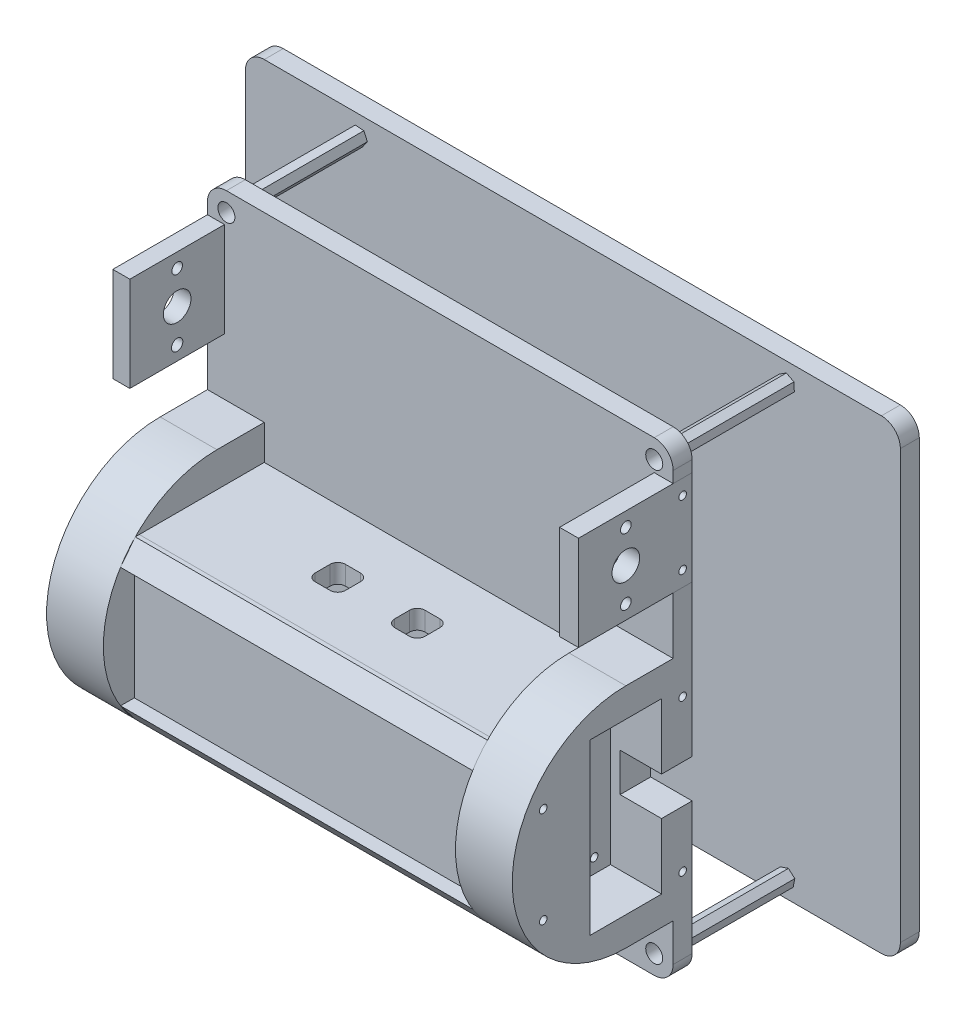
from build123d import *

# Parameters (mm, degrees)
RESSALTO_EXTRUS_O1_DEPTH      = 5
ESBO_O4_W                     = 4.495494134
ESBO_O4_H                     = 25
CORTE_EXTRUS_O2_DEPTH         = 5
RESSALTO_EXTRUS_O2_DEPTH      = 25
RESSALTO_EXTRUS_O2_DEPTH_BACK = 5
ESBO_O5_W                     = 4.495494134
ESBO_O5_H                     = 25
ESBO_O6_R                     = 1
CORTE_EXTRUS_O3_DEPTH         = 10
ESBO_O7_R                     = 1
CORTE_EXTRUS_O4_DEPTH         = 10
ESBO_O8_R                     = 3.65
CORTE_EXTRUS_O5_DEPTH         = 10
ESBO_O9_R                     = 1.4
CORTE_EXTRUS_O6_DEPTH         = 10
ESBO_O10_R                    = 1.5
CORTE_EXTRUS_O7_DEPTH         = 10
ESBO_O11_W                    = 5
ESBO_O11_H                    = 25
CORTE_EXTRUS_O8_DEPTH         = 10
RESSALTO_EXTRUS_O3_DEPTH      = 25
RESSALTO_EXTRUS_O3_DEPTH_BACK = 5
ESBO_O16_W                    = 5
ESBO_O16_H                    = 25
CORTE_EXTRUS_O9_START         = -10
ESBO_O17_R                    = 1
CORTE_EXTRUS_O9_DEPTH         = 10
CORTE_EXTRUS_O10_START        = -10
ESBO_O18_R                    = 1
CORTE_EXTRUS_O10_DEPTH        = 10
ESBO_O20_R                    = 3.65
CORTE_EXTRUS_O11_DEPTH        = 6
ESBO_O22_R                    = 1.4
CORTE_EXTRUS_O12_DEPTH        = 5
ESBO_O23_R                    = 1.4
CORTE_EXTRUS_O13_DEPTH        = 5
ESBO_O24_W                    = 15
ESBO_O24_H                    = 60
CORTE_EXTRUS_O14_DEPTH        = 10
ESBO_O27_W                    = 15
ESBO_O27_H                    = 60
CORTE_EXTRUS_O16_DEPTH        = 25
RESSALTO_EXTRUS_O7_DEPTH      = 12.5
RESSALTO_EXTRUS_O7_DEPTH_BACK = 5
ESBO_O32_W                    = 15
ESBO_O32_H                    = 60
RESSALTO_EXTRUS_O8_DEPTH      = 15
RESSALTO_EXTRUS_O9_DEPTH      = 12.5
RESSALTO_EXTRUS_O9_DEPTH_BACK = 5
ESBO_O34_W                    = 15
ESBO_O34_H                    = 60
RESSALTO_EXTRUS_O10_DEPTH     = 15
ESBO_O36_R                    = 1
CORTE_EXTRUS_O18_DEPTH        = 20
CORTE_EXTRUS_O19_START        = -20
ESBO_O37_R                    = 1
CORTE_EXTRUS_O19_DEPTH        = 20
ESBO_O39_W                    = 18.85
ESBO_O39_H                    = 44.705
CORTE_EXTRUS_O20_DEPTH        = 13.49
ESBO_O43_W                    = 10.95
ESBO_O43_H                    = 10.16
CORTE_EXTRUS_O23_DEPTH        = 10
ESBO_O44_W                    = 33
ESBO_O44_H                    = 5
RESSALTO_EXTRUS_O11_DEPTH     = 93
ESBO_O47_W                    = 33
ESBO_O47_H                    = 5
RESSALTO_EXTRUS_O12_DEPTH     = 93
ESBO_O41_R                    = 1.6255
ESBO_O41_R_2                  = 1
CORTE_EXTRUS_O25_DEPTH        = 31
ESBO_O42_R                    = 1.6255
ESBO_O42_R_2                  = 1
CORTE_EXTRUS_O26_DEPTH        = 31
ESBO_O52_W                    = 18.85
ESBO_O52_H                    = 44.705
CORTE_EXTRUS_O27_DEPTH        = 13.49
ESBO_O54_W                    = 10.951
ESBO_O54_H                    = 10.16
CORTE_EXTRUS_O28_DEPTH        = 24
ESBO_O55_R                    = 1.6255
ESBO_O55_R_2                  = 1
CORTE_EXTRUS_O29_DEPTH        = 31
ESBO_O56_W                    = 5
ESBO_O56_H                    = 31.69504285
RESSALTO_EXTRUS_O13_DEPTH     = 93
RESSALTO_EXTRUS_O15_DEPTH     = 93
RESSALTO_EXTRUS_O16_DEPTH     = 93
ESBO_O62_R                    = 1
CORTE_EXTRUS_O30_DEPTH        = 14
CORTE_EXTRUS_O31_DEPTH        = 10
ESBO_O65_R                    = 2.25
CORTE_EXTRUS_O32_DEPTH        = 10
RESSALTO_EXTRUS_O17_DEPTH     = 30
RESSALTO_EXTRUS_O17_2_DEPTH   = 30
RESSALTO_EXTRUS_O17_3_DEPTH   = 30
RESSALTO_EXTRUS_O17_4_DEPTH   = 30
RESSALTO_EXTRUS_O18_DEPTH     = 5
ESBO_O69_R                    = 1.6255
CORTE_EXTRUS_O33_DEPTH        = 10
ESBO_O71_R                    = 1.6255
CORTE_EXTRUS_O34_DEPTH        = 10


with BuildPart() as part:
    # Esboço1 → Ressalto-extrusão1 (new body)
    with BuildSketch(Plane.XY):
        with BuildLine():
            Line((-47.810925728, 58.485502959), (65.189074272, 58.485502959))
            ThreePointArc((65.189074272, 58.485502959), (68.724608178, 57.021036865), (70.189074272, 53.485502959))
            Line((70.189074272, 53.485502959), (70.189074272, -59.514497041))
            ThreePointArc((70.189074272, -59.514497041), (68.724608178, -63.050030947), (65.189074272, -64.514497041))
            Line((65.189074272, -64.514497041), (-47.810925728, -64.514497041))
            ThreePointArc((-47.810925728, -64.514497041), (-51.346459634, -63.050030947), (-52.810925728, -59.514497041))
            Line((-52.810925728, -59.514497041), (-52.810925728, 53.485502959))
            ThreePointArc((-52.810925728, 53.485502959), (-51.346459634, 57.021036865), (-47.810925728, 58.485502959))
        make_face()
    extrude(amount=RESSALTO_EXTRUS_O1_DEPTH)

    # Esboço4 → Corte-extrusão2 (cut)
    with BuildSketch(Plane.XY.offset(5)):
        with Locations((-50.563178661, 37.985502959)):
            Rectangle(ESBO_O4_W, ESBO_O4_H)
    extrude(amount=-CORTE_EXTRUS_O2_DEPTH, mode=Mode.SUBTRACT)


with BuildPart() as body_2:
    # Esboço5 → Ressalto-extrusão2 (new, two sides: drawn at the far end of the back side and taken through both)
    with BuildSketch(Plane.XY.offset(5).offset(-RESSALTO_EXTRUS_O2_DEPTH_BACK)):
        with Locations((-50.563178661, 37.985502959)):
            Rectangle(ESBO_O5_W, ESBO_O5_H)
    extrude(amount=RESSALTO_EXTRUS_O2_DEPTH + RESSALTO_EXTRUS_O2_DEPTH_BACK)


with BuildPart() as corte_extrus_o3_tool:
    # Esboço6 → Corte-extrusão3 (new body)
    with BuildSketch(Plane.ZY.offset(52.810925728)):
        with Locations((2.5, 46.485502959)):
            Circle(ESBO_O6_R)
    extrude(amount=-CORTE_EXTRUS_O3_DEPTH)


with BuildPart() as part_1:
    add(part.part)

    # Corte-extrusão3: cut by corte_extrus_o3_tool
    add(corte_extrus_o3_tool.part, mode=Mode.SUBTRACT)


with BuildPart() as body_2_1:
    add(body_2.part)

    # Corte-extrusão3: cut by corte_extrus_o3_tool
    add(corte_extrus_o3_tool.part, mode=Mode.SUBTRACT)


with BuildPart() as corte_extrus_o4_tool:
    # Esboço7 → Corte-extrusão4 (new body)
    with BuildSketch(Plane.ZY.offset(52.810925728)):
        with Locations((2.5, 29.485502959)):
            Circle(ESBO_O7_R)
    extrude(amount=-CORTE_EXTRUS_O4_DEPTH)


with BuildPart() as part_2:
    add(part_1.part)

    # Corte-extrusão4: cut by corte_extrus_o4_tool
    add(corte_extrus_o4_tool.part, mode=Mode.SUBTRACT)

    # Esboço11 → Corte-extrusão8 (cut)
    with BuildSketch(Plane.XY.offset(5)):
        with Locations((67.689074272, 37.985502959)):
            Rectangle(ESBO_O11_W, ESBO_O11_H)
    extrude(amount=-CORTE_EXTRUS_O8_DEPTH, mode=Mode.SUBTRACT)


with BuildPart() as body_2_2:
    add(body_2_1.part)

    # Corte-extrusão4: cut by corte_extrus_o4_tool
    add(corte_extrus_o4_tool.part, mode=Mode.SUBTRACT)

    # Esboço8 → Corte-extrusão5 (cut)
    with BuildSketch(Plane(origin=(-48.315431594, 0, 0), x_dir=(0, 0, -1), z_dir=(1, 0, 0))):
        with Locations((-17.5, 37.985502959)):
            Circle(ESBO_O8_R)
    extrude(amount=-CORTE_EXTRUS_O5_DEPTH, mode=Mode.SUBTRACT)

    # Esboço9 → Corte-extrusão6 (cut)
    with BuildSketch(Plane.ZY.offset(52.810925728)):
        with Locations((17.5, 46.735502959)):
            Circle(ESBO_O9_R)
    extrude(amount=-CORTE_EXTRUS_O6_DEPTH, mode=Mode.SUBTRACT)

    # Esboço10 → Corte-extrusão7 (cut)
    with BuildSketch(Plane.ZY.offset(52.810925728)):
        with Locations((17.5, 29.235502959)):
            Circle(ESBO_O10_R)
    extrude(amount=-CORTE_EXTRUS_O7_DEPTH, mode=Mode.SUBTRACT)


with BuildPart() as body_3:
    # Esboço16 → Ressalto-extrusão3 (new, two sides: drawn at the far end of the back side and taken through both)
    with BuildSketch(Plane.XY.offset(5).offset(-RESSALTO_EXTRUS_O3_DEPTH_BACK)):
        with Locations((67.689074272, 37.985502959)):
            Rectangle(ESBO_O16_W, ESBO_O16_H)
    extrude(amount=RESSALTO_EXTRUS_O3_DEPTH + RESSALTO_EXTRUS_O3_DEPTH_BACK)


with BuildPart() as corte_extrus_o9_tool:
    # Esboço17 → Corte-extrusão9 (new body)
    with BuildSketch(Plane(origin=(70.189074272, 0, 0), x_dir=(0, 0, -1), z_dir=(1, 0, 0)).offset(CORTE_EXTRUS_O9_START)):
        with Locations((-2.5, 46.485502959)):
            Circle(ESBO_O17_R)
    extrude(amount=CORTE_EXTRUS_O9_DEPTH)


with BuildPart() as part_3:
    add(part_2.part)

    # Corte-extrusão9: cut by corte_extrus_o9_tool
    add(corte_extrus_o9_tool.part, mode=Mode.SUBTRACT)


with BuildPart() as body_3_1:
    add(body_3.part)

    # Corte-extrusão9: cut by corte_extrus_o9_tool
    add(corte_extrus_o9_tool.part, mode=Mode.SUBTRACT)


with BuildPart() as corte_extrus_o10_tool:
    # Esboço18 → Corte-extrusão10 (new body)
    with BuildSketch(Plane(origin=(70.189074272, 0, 0), x_dir=(0, 0, -1), z_dir=(1, 0, 0)).offset(CORTE_EXTRUS_O10_START)):
        with Locations((-2.5, 29.485502959)):
            Circle(ESBO_O18_R)
    extrude(amount=CORTE_EXTRUS_O10_DEPTH)


with BuildPart() as part_4:
    add(part_3.part)

    # Corte-extrusão10: cut by corte_extrus_o10_tool
    add(corte_extrus_o10_tool.part, mode=Mode.SUBTRACT)

    # Esboço24 → Corte-extrusão14 (cut)
    with BuildSketch(Plane.XY.offset(5)):
        with Locations((-45.310925728, -19.514497041)):
            Rectangle(ESBO_O24_W, ESBO_O24_H)
    extrude(amount=-CORTE_EXTRUS_O14_DEPTH, mode=Mode.SUBTRACT)

    # Esboço27 → Corte-extrusão16 (cut)
    with BuildSketch(Plane.XY.offset(5)):
        with Locations((62.689074272, -19.514497041)):
            Rectangle(ESBO_O27_W, ESBO_O27_H)
    extrude(amount=-CORTE_EXTRUS_O16_DEPTH, mode=Mode.SUBTRACT)


with BuildPart() as body_3_2:
    add(body_3_1.part)

    # Corte-extrusão10: cut by corte_extrus_o10_tool
    add(corte_extrus_o10_tool.part, mode=Mode.SUBTRACT)

    # Esboço20 → Corte-extrusão11 (cut)
    with BuildSketch(Plane(origin=(70.189074272, 0, 0), x_dir=(0, 0, -1), z_dir=(1, 0, 0))):
        with Locations((-17.5, 37.985502959)):
            Circle(ESBO_O20_R)
    extrude(amount=-CORTE_EXTRUS_O11_DEPTH, mode=Mode.SUBTRACT)

    # Esboço22 → Corte-extrusão12 (cut)
    with BuildSketch(Plane(origin=(70.189074272, 0, 0), x_dir=(0, 0, -1), z_dir=(1, 0, 0))):
        with Locations((-17.5, 46.735502959)):
            Circle(ESBO_O22_R)
    extrude(amount=-CORTE_EXTRUS_O12_DEPTH, mode=Mode.SUBTRACT)

    # Esboço23 → Corte-extrusão13 (cut)
    with BuildSketch(Plane(origin=(70.189074272, 0, 0), x_dir=(0, 0, -1), z_dir=(1, 0, 0))):
        with Locations((-17.5, 29.235502959)):
            Circle(ESBO_O23_R)
    extrude(amount=-CORTE_EXTRUS_O13_DEPTH, mode=Mode.SUBTRACT)


with BuildPart() as body_4:
    # Esboço32 → Ressalto-extrusão7 (new, two sides: drawn at the far end of the back side and taken through both)
    with BuildSketch(Plane.XY.offset(5).offset(-RESSALTO_EXTRUS_O7_DEPTH_BACK)):
        with Locations((-45.310925728, -19.514497041)):
            Rectangle(ESBO_O32_W, ESBO_O32_H)
    extrude(amount=RESSALTO_EXTRUS_O7_DEPTH + RESSALTO_EXTRUS_O7_DEPTH_BACK)


with BuildPart() as body_5:
    # Esboço33 → Ressalto-extrusão8 (new body)
    with BuildSketch(Plane.ZY.offset(52.810925728)):
        with BuildLine():
            Line((0, -49.514497041), (17.5, -49.514497041))
            ThreePointArc((17.5, -49.514497041), (47.5, -19.514497041), (17.5, 10.485502959))
            Line((17.5, 10.485502959), (0, 10.485502959))
            Line((0, 10.485502959), (0, -49.514497041))
        make_face()
    extrude(amount=-RESSALTO_EXTRUS_O8_DEPTH)


with BuildPart() as body_6:
    # Esboço34 → Ressalto-extrusão9 (new, two sides: drawn at the far end of the back side and taken through both)
    with BuildSketch(Plane.XY.offset(5).offset(-RESSALTO_EXTRUS_O9_DEPTH_BACK)):
        with Locations((62.689074272, -19.514497041)):
            Rectangle(ESBO_O34_W, ESBO_O34_H)
    extrude(amount=RESSALTO_EXTRUS_O9_DEPTH + RESSALTO_EXTRUS_O9_DEPTH_BACK)


with BuildPart() as body_7:
    # Esboço35 → Ressalto-extrusão10 (new body)
    with BuildSketch(Plane(origin=(70.189074272, 0, 0), x_dir=(0, 0, -1), z_dir=(1, 0, 0))):
        with BuildLine():
            Line((0, 10.485502959), (-17.5, 10.485502959))
            ThreePointArc((-17.5, 10.485502959), (-47.5, -19.514497041), (-17.5, -49.514497041))
            Line((-17.5, -49.514497041), (0, -49.514497041))
            Line((0, -49.514497041), (0, 10.485502959))
        make_face()
    extrude(amount=-RESSALTO_EXTRUS_O10_DEPTH)


with BuildPart() as corte_extrus_o18_tool:
    # Esboço36 → Corte-extrusão18 (new body)
    with BuildSketch(Plane(origin=(70.189074272, 0, 0), x_dir=(0, 0, -1), z_dir=(1, 0, 0))):
        with Locations((-2.5, -39.514497041)):
            Circle(ESBO_O36_R)
        with Locations((-2.5, 0.485502959)):
            Circle(ESBO_O36_R)
    extrude(amount=-CORTE_EXTRUS_O18_DEPTH)


with BuildPart() as part_5:
    add(part_4.part)

    # Corte-extrusão18: cut by corte_extrus_o18_tool
    add(corte_extrus_o18_tool.part, mode=Mode.SUBTRACT)


with BuildPart() as body_6_1:
    add(body_6.part)

    # Corte-extrusão18: cut by corte_extrus_o18_tool
    add(corte_extrus_o18_tool.part, mode=Mode.SUBTRACT)


with BuildPart() as body_7_1:
    add(body_7.part)

    # Corte-extrusão18: cut by corte_extrus_o18_tool
    add(corte_extrus_o18_tool.part, mode=Mode.SUBTRACT)


with BuildPart() as corte_extrus_o19_tool:
    # Esboço37 → Corte-extrusão19 (new body)
    with BuildSketch(Plane.ZY.offset(52.810925728).offset(CORTE_EXTRUS_O19_START)):
        with Locations((2.5, 0.485502959)):
            Circle(ESBO_O37_R)
        with Locations((2.5, -39.514497041)):
            Circle(ESBO_O37_R)
    extrude(amount=CORTE_EXTRUS_O19_DEPTH)


with BuildPart() as part_6:
    add(part_5.part)

    # Corte-extrusão19: cut by corte_extrus_o19_tool
    add(corte_extrus_o19_tool.part, mode=Mode.SUBTRACT)



with BuildPart() as body_4_1:
    add(body_4.part)

    # Corte-extrusão19: cut by corte_extrus_o19_tool
    add(corte_extrus_o19_tool.part, mode=Mode.SUBTRACT)


with BuildPart() as body_5_1:
    add(body_5.part)

    # Corte-extrusão19: cut by corte_extrus_o19_tool
    add(corte_extrus_o19_tool.part, mode=Mode.SUBTRACT)


with BuildPart() as corte_extrus_o20_tool:
    # Esboço39 → Corte-extrusão20 (new body)
    with BuildSketch(Plane(origin=(70.189074272, 0, 0), x_dir=(0, 0, -1), z_dir=(1, 0, 0))):
        with Locations((-17.491326567, -19.523544175)):
            Rectangle(ESBO_O39_W, ESBO_O39_H)
    extrude(amount=-CORTE_EXTRUS_O20_DEPTH)


with BuildPart() as body_6_2:
    add(body_6_1.part)

    # Corte-extrusão20: cut by corte_extrus_o20_tool
    add(corte_extrus_o20_tool.part, mode=Mode.SUBTRACT)


with BuildPart() as body_7_2:
    add(body_7_1.part)

    # Corte-extrusão20: cut by corte_extrus_o20_tool
    add(corte_extrus_o20_tool.part, mode=Mode.SUBTRACT)


with BuildPart() as corte_extrus_o23_tool:
    # Esboço43 → Corte-extrusão23 (new body)
    with BuildSketch(Plane.XY.offset(8.066326567)):
        with Locations((64.714074272, -19.514497041)):
            Rectangle(ESBO_O43_W, ESBO_O43_H)
    extrude(amount=-CORTE_EXTRUS_O23_DEPTH)


with BuildPart() as body_6_3:
    add(body_6_2.part)

    # Corte-extrusão23: cut by corte_extrus_o23_tool
    add(corte_extrus_o23_tool.part, mode=Mode.SUBTRACT)


with BuildPart() as body_7_3:
    add(body_7_2.part)

    # Corte-extrusão23: cut by corte_extrus_o23_tool
    add(corte_extrus_o23_tool.part, mode=Mode.SUBTRACT)


with BuildPart() as body_8:
    # Esboço44 → Ressalto-extrusão11 (new body)
    with BuildSketch(Plane.ZY.offset(-55.189074272)):
        with Locations((21.5, -1.169454191)):
            Rectangle(ESBO_O44_W, ESBO_O44_H)
    extrude(amount=RESSALTO_EXTRUS_O11_DEPTH)


with BuildPart() as part_7:
    add(part_6.part)

    add(body_4_1.part)  # Ressalto-extrusão12 merges body 4

    add(body_5_1.part)  # Ressalto-extrusão12 merges body 5

    add(body_6_3.part)  # Ressalto-extrusão12 merges body 6

    add(body_7_3.part)  # Ressalto-extrusão12 merges body 7
    # Esboço47 → Ressalto-extrusão12 (add)
    with BuildSketch(Plane.ZY.offset(-55.189074272)):
        with Locations((21.5, -37.864497041)):
            Rectangle(ESBO_O47_W, ESBO_O47_H)
    extrude(amount=RESSALTO_EXTRUS_O12_DEPTH)


with BuildPart() as corte_extrus_o25_tool:
    # Esboço41 → Corte-extrusão25 (new body)
    with BuildSketch(Plane(origin=(56.699074272, 0, 0), x_dir=(0, 0, -1), z_dir=(1, 0, 0))):
        with Locations((-20.375326567, -0.981044175)):
            Circle(ESBO_O41_R)
        with Locations((-12.375326567, -0.981044175)):
            Circle(ESBO_O41_R_2)
    extrude(amount=-CORTE_EXTRUS_O25_DEPTH)


with BuildPart() as part_8:
    add(part_7.part)

    # Corte-extrusão25: cut by corte_extrus_o25_tool
    add(corte_extrus_o25_tool.part, mode=Mode.SUBTRACT)

    # Esboço42 → Corte-extrusão26 (cut)
    with BuildSketch(Plane(origin=(56.699074272, 0, 0), x_dir=(0, 0, -1), z_dir=(1, 0, 0))):
        with Locations((-20.375326567, -38.066044175)):
            Circle(ESBO_O42_R)
        with Locations((-12.375326567, -38.066044175)):
            Circle(ESBO_O42_R_2)
    extrude(amount=-CORTE_EXTRUS_O26_DEPTH, mode=Mode.SUBTRACT)

    # Esboço52 → Corte-extrusão27 (cut)
    with BuildSketch(Plane.ZY.offset(52.810925728)):
        with Locations((20.248234245, -19.506997041)):
            Rectangle(ESBO_O52_W, ESBO_O52_H)
    extrude(amount=-CORTE_EXTRUS_O27_DEPTH, mode=Mode.SUBTRACT)

    # Esboço54 → Corte-extrusão28 (cut)
    with BuildSketch(Plane.XY.offset(10.823234245)):
        with Locations((-47.335425728, -19.514497041)):
            Rectangle(ESBO_O54_W, ESBO_O54_H)
    extrude(amount=-CORTE_EXTRUS_O28_DEPTH, mode=Mode.SUBTRACT)


with BuildPart() as body_8_1:
    add(body_8.part)

    # Corte-extrusão25: cut by corte_extrus_o25_tool
    add(corte_extrus_o25_tool.part, mode=Mode.SUBTRACT)


with BuildPart() as corte_extrus_o29_tool:
    # Esboço55 → Corte-extrusão29 (new body)
    with BuildSketch(Plane.ZY.offset(39.320925728)):
        with Locations((23.133234245, -0.964497041)):
            Circle(ESBO_O55_R)
        with Locations((23.133234245, -38.049497041)):
            Circle(ESBO_O55_R)
        with Locations((15.133234245, -0.964497041)):
            Circle(ESBO_O55_R_2)
        with Locations((15.133234245, -38.049497041)):
            Circle(ESBO_O55_R_2)
    extrude(amount=-CORTE_EXTRUS_O29_DEPTH)


with BuildPart() as part_9:
    add(part_8.part)

    # Corte-extrusão29: cut by corte_extrus_o29_tool
    add(corte_extrus_o29_tool.part, mode=Mode.SUBTRACT)



with BuildPart() as body_8_2:
    add(body_8_1.part)

    # Corte-extrusão29: cut by corte_extrus_o29_tool
    add(corte_extrus_o29_tool.part, mode=Mode.SUBTRACT)


with BuildPart() as part_10:
    add(part_9.part)

    add(body_8_2.part)  # Ressalto-extrusão13 merges body 8
    # Esboço56 → Ressalto-extrusão13 (add)
    with BuildSketch(Plane.ZY.offset(-55.189074272)):
        with Locations((36.82, -19.516975616)):
            Rectangle(ESBO_O56_W, ESBO_O56_H)
    extrude(amount=RESSALTO_EXTRUS_O13_DEPTH)

    # Esboço62 → Corte-extrusão30 (cut)
    with BuildSketch(Plane(origin=(70.189074272, 0, 0), x_dir=(0, 0, -1), z_dir=(1, 0, 0))):
        with Locations(Location((-39.32, -32.229996518, 0), (0, 0, 90))):
            Circle(ESBO_O62_R)
        with Locations(Location((-39.32, -6.799454191, 0), (0, 0, 90))):
            Circle(ESBO_O62_R)
    extrude(amount=-CORTE_EXTRUS_O30_DEPTH, mode=Mode.SUBTRACT)

    # Esboço64 → Corte-extrusão31 (cut)
    with BuildSketch(Plane(origin=(0, 1.330545809, 0), x_dir=(1, 0, 0), z_dir=(0, 1, 0))):
        with BuildLine():
            Line((21.189074272, -25.587814631), (17.189074272, -25.587814631))
            ThreePointArc((17.189074272, -25.587814631), (15.774860709, -25.002028193), (15.189074272, -23.587814631))
            Line((15.189074272, -23.587814631), (15.189074272, -19.587814631))
            ThreePointArc((15.189074272, -19.587814631), (15.774860709, -18.173601068), (17.189074272, -17.587814631))
            Line((17.189074272, -17.587814631), (21.189074272, -17.587814631))
            ThreePointArc((21.189074272, -17.587814631), (22.603287834, -18.173601068), (23.189074272, -19.587814631))
            Line((23.189074272, -19.587814631), (23.189074272, -23.587814631))
            ThreePointArc((23.189074272, -23.587814631), (22.603287834, -25.002028193), (21.189074272, -25.587814631))
        make_face()
        with BuildLine():
            Line((0.189074272, -25.587814631), (-3.810925728, -25.587814631))
            ThreePointArc((-3.810925728, -25.587814631), (-5.225139291, -25.002028193), (-5.810925728, -23.587814631))
            Line((-5.810925728, -23.587814631), (-5.810925728, -19.587814631))
            ThreePointArc((-5.810925728, -19.587814631), (-5.225139291, -18.173601068), (-3.810925728, -17.587814631))
            Line((-3.810925728, -17.587814631), (0.189074272, -17.587814631))
            ThreePointArc((0.189074272, -17.587814631), (1.603287834, -18.173601068), (2.189074272, -19.587814631))
            Line((2.189074272, -19.587814631), (2.189074272, -23.587814631))
            ThreePointArc((2.189074272, -23.587814631), (1.603287834, -25.002028193), (0.189074272, -25.587814631))
        make_face()
    extrude(amount=-CORTE_EXTRUS_O31_DEPTH, mode=Mode.SUBTRACT)

    # Esboço65 → Corte-extrusão32 (cut)
    with BuildSketch(Plane(origin=(0, 0, 0), x_dir=(-1, 0, 0), z_dir=(0, 0, -1))):
        with Locations((47.810925728, -59.514497041)):
            Circle(ESBO_O65_R)
        with Locations((47.810925728, 53.485502959)):
            Circle(ESBO_O65_R)
        with Locations((-65.189074272, 53.485502959)):
            Circle(ESBO_O65_R)
        with Locations((-65.189074272, -59.514497041)):
            Circle(ESBO_O65_R)
    extrude(amount=-CORTE_EXTRUS_O32_DEPTH, mode=Mode.SUBTRACT)

    # Esboço69 → Corte-extrusão33 (cut)
    with BuildSketch(Plane.XZ.offset(40.364497041)):
        with Locations(Location((-9.853425728, 27, 0), (0, 0, 270))):
            Circle(ESBO_O69_R)
    extrude(amount=-CORTE_EXTRUS_O33_DEPTH, mode=Mode.SUBTRACT)

    # Esboço71 → Corte-extrusão34 (cut)
    with BuildSketch(Plane.XZ.offset(40.364497041)):
        with Locations(Location((27.231574272, 27, 0), (0, 0, 270))):
            Circle(ESBO_O71_R)
    extrude(amount=-CORTE_EXTRUS_O34_DEPTH, mode=Mode.SUBTRACT)


with BuildPart() as body_4_2:
    # Esboço59 → Ressalto-extrusão15 (new body)
    with BuildSketch(Plane.ZY.offset(-55.189074272)):
        Polygon((38, 1.330545809), (38, -3.669454191), (42.974195121, -3.669454191), (39.075082585, 1.330545809), align=None)
    extrude(amount=RESSALTO_EXTRUS_O15_DEPTH)


with BuildPart() as body_5_2:
    # Esboço61 → Ressalto-extrusão16 (new body)
    with BuildSketch(Plane.ZY.offset(-55.189074272)):
        Polygon((38, -40.364497041), (38, -35.364497041), (42.971111087, -35.364497041), (39.07029207, -40.364497041), align=None)
    extrude(amount=RESSALTO_EXTRUS_O16_DEPTH)


with BuildPart() as body_6_2_1:
    # Esboço66 → Ressalto-extrusão17 (new body)
    with BuildSketch(Plane(origin=(0, 0, 0), x_dir=(-1, 0, 0), z_dir=(0, 0, -1))):
        Polygon((45.679316747, -58.794258783), (46.121376609, -61.000405441), (48.25298559, -61.7206437), (49.94253471, -60.2347353), (49.500474848, -58.028588642), (47.368865866, -57.308350383), align=None)
    extrude(amount=RESSALTO_EXTRUS_O17_DEPTH)


with BuildPart() as body_7_2_1:
    # Esboço66 → Ressalto-extrus_o17 2 (new body)
    with BuildSketch(Plane(origin=(0, 0, 0), x_dir=(-1, 0, 0), z_dir=(0, 0, -1))):
        Polygon((-67.320683253, -58.794258783), (-66.878623391, -61.000405441), (-64.74701441, -61.7206437), (-63.05746529, -60.2347353), (-63.499525152, -58.028588642), (-65.631134134, -57.308350383), align=None)
    extrude(amount=RESSALTO_EXTRUS_O17_2_DEPTH)


with BuildPart() as body_8_2_1:
    # Esboço66 → Ressalto-extrus_o17 3 (new body)
    with BuildSketch(Plane(origin=(0, 0, 0), x_dir=(-1, 0, 0), z_dir=(0, 0, -1))):
        Polygon((-67.085502315, 54.696312885), (-67.185880449, 52.44855306), (-65.289452406, 51.237743134), (-63.292646229, 52.274693032), (-63.192268095, 54.522452857), (-65.088696138, 55.733262783), align=None)
    extrude(amount=RESSALTO_EXTRUS_O17_3_DEPTH)


with BuildPart() as body_9:
    # Esboço66 → Ressalto-extrus_o17 4 (new body)
    with BuildSketch(Plane(origin=(0, 0, 0), x_dir=(-1, 0, 0), z_dir=(0, 0, -1))):
        Polygon((46.524091306, 55.331189056), (45.569097469, 53.293914708), (46.855931891, 51.44822861), (49.09776015, 51.639816861), (50.052753987, 53.67709121), (48.765919565, 55.522777307), align=None)
    extrude(amount=RESSALTO_EXTRUS_O17_4_DEPTH)


with BuildPart() as body_10:
    # Esboço68 → Ressalto-extrusão18 (new body)
    with BuildSketch(Plane(origin=(0, 0, -30), x_dir=(-1, 0, 0), z_dir=(0, 0, -1))):
        with BuildLine():
            Line((-90.189074272, 58.485502959), (72.810925728, 58.485502959))
            ThreePointArc((72.810925728, 58.485502959), (76.346459634, 57.021036865), (77.810925728, 53.485502959))
            Line((77.810925728, 53.485502959), (77.810925728, -59.514497041))
            ThreePointArc((77.810925728, -59.514497041), (76.346459634, -63.050030947), (72.810925728, -64.514497041))
            Line((72.810925728, -64.514497041), (-90.189074272, -64.514497041))
            ThreePointArc((-90.189074272, -64.514497041), (-93.724608178, -63.050030947), (-95.189074272, -59.514497041))
            Line((-95.189074272, -59.514497041), (-95.189074272, 53.485502959))
            ThreePointArc((-95.189074272, 53.485502959), (-93.724608178, 57.021036865), (-90.189074272, 58.485502959))
        make_face()
    extrude(amount=RESSALTO_EXTRUS_O18_DEPTH)


solid = Compound([body_2_2.part, body_3_2.part, part_10.part, body_4_2.part, body_5_2.part, body_6_2_1.part, body_7_2_1.part, body_8_2_1.part, body_9.part, body_10.part])
